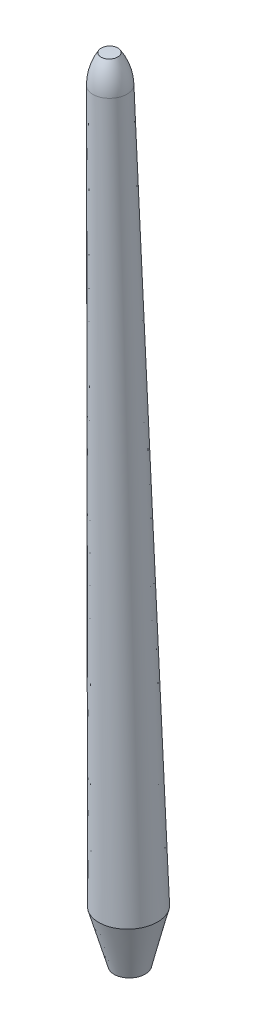
from build123d import *


with BuildPart() as part:
    # Croquis1 → Revolución2 (revolve)
    with BuildSketch(Plane.XY):
        with BuildLine():
            Line((0, 0), (190.5, 0))
            Line((190.5, 0), (342.973642594, 635))
            Line((342.973642594, 635), (-35.551434207, 9311.655218085))
            ThreePointArc((-35.551434207, 9311.655218085), (-68.944322041, 9490.034521793), (-150.806674916, 9652))
            Line((-150.806674916, 9652), (-252.406674916, 9652))
            Line((-252.406674916, 9652), (0, 0))
        make_face()
    revolve(axis=Axis((0, 0, 0), (-0.026141775152621272, 0.9996582453978309, 0)))


solid = part.part
